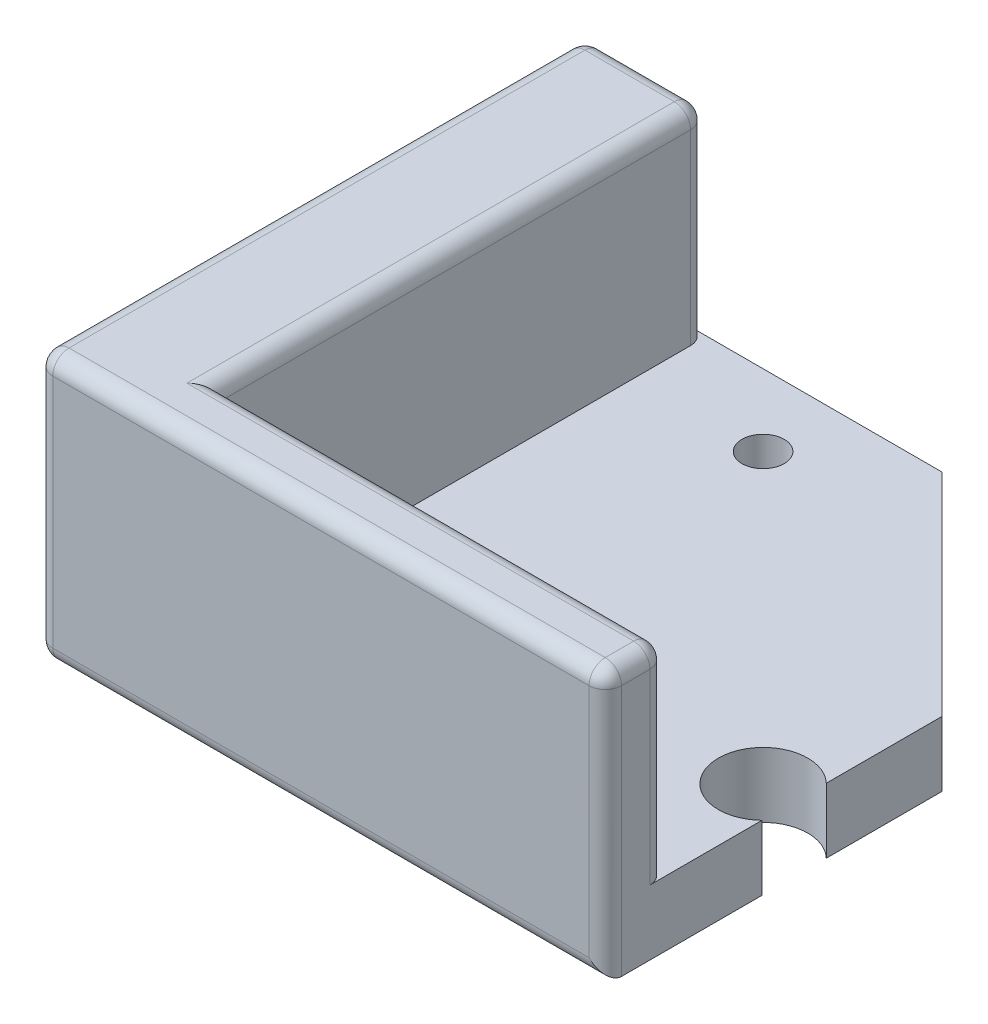
from build123d import *

# Parameters (mm, degrees)
BOSS_EXTRUDE1_DEPTH      = 2.54
SKETCH2_W                = 9.525
SKETCH2_H                = 38.1
BOSS_EXTRUDE2_DEPTH      = 15.875
BOSS_EXTRUDE3_DEPTH      = 5.08
M3_CLEARANCE_HOLE1_D     = 3.3
M3_CLEARANCE_HOLE1_DEPTH = 12.7
M3_CLEARANCE_HOLE1_TIP   = 0.991420021
SKETCH7_W                = 35.71875
SKETCH7_H                = 2.38125
CUT_EXTRUDE1_DEPTH       = 2.54
FILLET1_R                = 1.27
SKETCH8_R                = 3.4925
CUT_EXTRUDE2_DEPTH       = 10.16
SKETCH9_W                = 1.905
SKETCH9_H                = 3.4925
CUT_EXTRUDE3_DEPTH       = 58.81290535
FILLET2_R                = 1.27


with BuildPart() as part:
    # Sketch1 → Boss-Extrude1 (new body)
    with BuildSketch(Plane(origin=(0, 0, 0), x_dir=(1, 0, 0), z_dir=(0, 1, 0))):
        Polygon((0, 0), (38.1, 0), (38.1, 2.38125), (2.38125, 2.38125), (2.38125, 38.1), (0, 38.1), align=None)
    extrude(amount=BOSS_EXTRUDE1_DEPTH)

    # Sketch2 → Boss-Extrude2 (add)
    with BuildSketch(Plane(origin=(0, 2.54, 0), x_dir=(1, 0, 0), z_dir=(0, 1, 0))):
        with Locations((-4.7625, 19.05)):
            Rectangle(SKETCH2_W, SKETCH2_H)
        Polygon((0, 0), (-9.525, 0), (-9.525, -9.525), (38.1, -9.525), (38.1, 0), align=None)
    extrude(amount=-BOSS_EXTRUDE2_DEPTH)

    # Sketch3 → Boss-Extrude3 (add)
    with BuildSketch(Plane(origin=(0, -13.335, 0), x_dir=(-1, 0, 0), z_dir=(0, -1, 0))):
        Polygon((9.525, -9.525), (-38.1, -9.525), (-38.1, 18.373079092), (-18.373079092, 38.1), (9.525, 38.1), align=None)
    extrude(amount=BOSS_EXTRUDE3_DEPTH)

    # M3 Clearance Hole1
    with Locations(Plane(origin=(0, -18.415, 0), x_dir=(-1, 0, 0), z_dir=(0, -1, 0))):
        with Locations((-10, 32.5), (-32.5, 10)):
            Hole(M3_CLEARANCE_HOLE1_D / 2, depth=M3_CLEARANCE_HOLE1_DEPTH)
            with Locations((0, 0, -(M3_CLEARANCE_HOLE1_DEPTH + M3_CLEARANCE_HOLE1_TIP / 2))):  # 118° drill point
                Cone(0, M3_CLEARANCE_HOLE1_D / 2, M3_CLEARANCE_HOLE1_TIP, mode=Mode.SUBTRACT)

    # Sketch7 → Cut-Extrude1 (cut)
    with BuildSketch(Plane(origin=(0, 2.54, 0), x_dir=(1, 0, 0), z_dir=(0, 1, 0))):
        with Locations((20.240625, 1.190625)):
            Rectangle(SKETCH7_W, SKETCH7_H)
        Polygon((0, 0), (2.38125, 0), (2.38125, 2.38125), (2.38125, 38.1), (0, 38.1), align=None)
    extrude(amount=-CUT_EXTRUDE1_DEPTH, mode=Mode.SUBTRACT)

    # Fillet1
    fillet1_edges = [part.edges().sort_by_distance(p)[0] for p in [
        (38.1, 2.54, 4.7625),
        (0, -5.3975, -38.1),
        (-9.525, -7.9375, -38.1),
        (38.1, -5.3975, 0),
        (14.2875, 2.54, 9.525),
        (38.1, -7.9375, 9.525),
        (-9.525, -7.9375, 9.525),
        (-9.525, 2.54, -14.2875),
        (-9.525, -18.415, -14.2875),
        (14.2875, -18.415, 9.525),
        (-4.7625, 2.54, -38.1),
        (0, 2.54, -19.05),
        (19.05, 2.54, 0),
    ]]
    fillet(fillet1_edges, radius=FILLET1_R)

    # Sketch8 → Cut-Extrude2 (cut)
    with BuildSketch(Plane(origin=(0, -13.335, 0), x_dir=(1, 0, 0), z_dir=(0, 1, 0))):
        with Locations(Location((32.5, 10, 0), (0, 0, 270))):
            Circle(SKETCH8_R)
    extrude(amount=-CUT_EXTRUDE2_DEPTH, mode=Mode.SUBTRACT)

    # Sketch9 → Cut-Extrude3 (cut, through all)
    with BuildSketch(Plane(origin=(0, 2.54, 0), x_dir=(1, 0, 0), z_dir=(0, 1, 0))):
        Polygon((36.83, -4.7625), (38.1, -4.7625), (38.1, 24.398350623), (34.925, 24.398350623), (34.925, -1.27), (36.83, -1.27), align=None)
        Polygon((36.83, -8.255), (36.83, -4.7625), (34.925, -4.7625), (-8.255, -4.7625), (-8.255, -8.255), align=None)
        Polygon((-20.834402164, -9.525), (38.1, -9.525), (38.1, -4.7625), (36.83, -4.7625), (36.83, -8.255), (-8.255, -8.255), (-8.255, -4.7625), (-20.834402164, -4.7625), align=None)
        with Locations((35.8775, -3.01625)):
            Rectangle(SKETCH9_W, SKETCH9_H)
    extrude(amount=-CUT_EXTRUDE3_DEPTH, mode=Mode.SUBTRACT)

    # Fillet2
    fillet2_edges = [part.edges().sort_by_distance(p)[0] for p in [
        (-9.153025612, 2.168025612, 4.7625),
        (-9.525, -7.9375, 4.7625),
        (-9.153025612, -18.043025612, 4.7625),
        (34.925, 2.54, 3.01625),
        (34.925, 2.168025612, 0.371974388),
        (34.925, -6.0325, 0),
        (34.925, -7.9375, 4.7625),
        (13.335, -18.415, 4.7625),
        (13.335, 2.54, 4.7625),
    ]]
    fillet(fillet2_edges, radius=FILLET2_R)


solid = part.part
